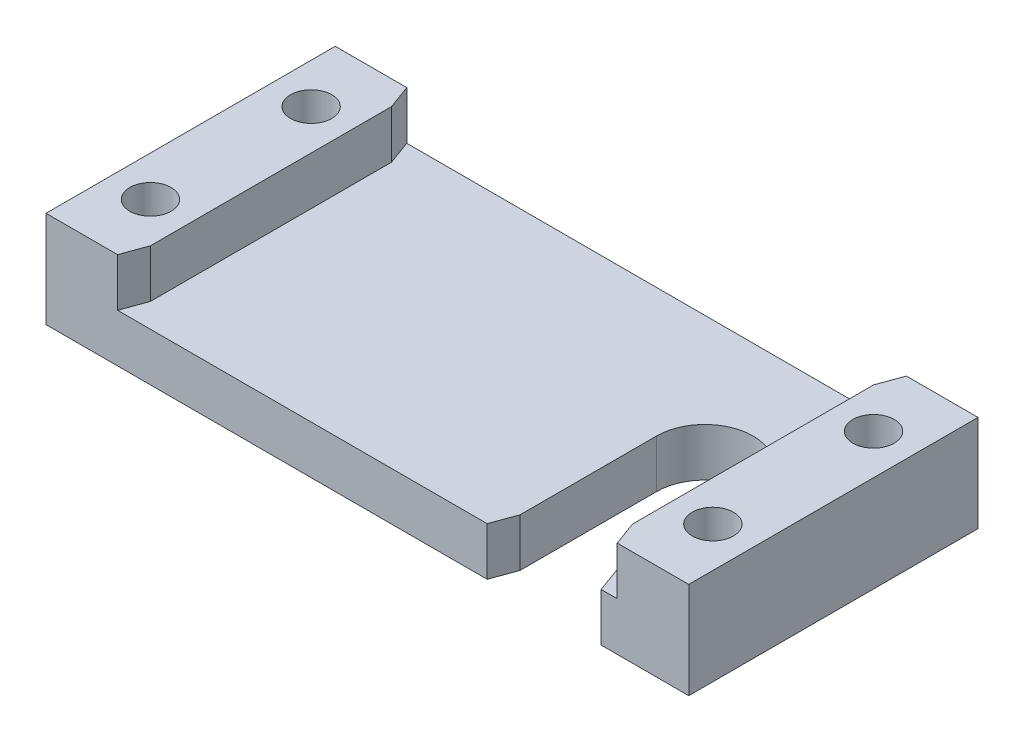
from build123d import *
from OCP.BRepFilletAPI import BRepFilletAPI_MakeChamfer

# Parameters (mm, degrees)
BOSS_EXTRUDE1_DEPTH   = 11.43
F_4_CLEARANCE_HOLE1_D = 3.2639
CUT_EXTRUDE1_DEPTH    = 29.112648399
CHAMFER1_SIZE         = 1.905
CHAMFER1_SIZE2        = 0.693363296


with BuildPart() as part:
    # Sketch1 → Boss-Extrude1 (new, symmetric)
    with BuildSketch(Plane.XY):
        Polygon((-19.05, 3.81), (-25.4, 3.81), (-25.4, -3.81), (25.4, -3.81), (25.4, 3.81), (19.05, 3.81), (19.05, 0), (-19.05, 0), align=None)
    extrude(amount=BOSS_EXTRUDE1_DEPTH, both=True)

    # #4 Clearance Hole1 (through all)
    with Locations(Plane(origin=(0, 3.81, 0), x_dir=(1, 0, 0), z_dir=(0, 1, 0))):
        with Locations((22.225, -6.35), (-22.225, 6.35), (-22.225, -6.35), (22.225, 6.35)):
            Hole(F_4_CLEARANCE_HOLE1_D / 2)

    # Sketch4 → Cut-Extrude1 (cut, through all)
    with BuildSketch(Plane(origin=(0, 0, 0), x_dir=(1, 0, 0), z_dir=(0, 1, 0))):
        with BuildLine():
            Line((17.78, -11.43), (17.78, 1.27))
            ThreePointArc((17.78, 1.27), (13.97, 5.08), (10.16, 1.27))
            Line((10.16, 1.27), (10.16, -11.43))
            Line((10.16, -11.43), (17.78, -11.43))
        make_face()
    extrude(amount=-CUT_EXTRUDE1_DEPTH, mode=Mode.SUBTRACT)

    # Chamfer1: one chamfer whose edges measure the first distance from different faces: ONE call of the kernel's chamfer builder (chamfer() names one face for all edges)
    chamfer1_edges_1 = [part.edges().sort_by_distance(p)[0] for p in [
        (19.05, 1.905, 11.43),
        (19.05, 1.905, -11.43),
    ]]
    chamfer1_side_1 = [part.faces().sort_by_distance(p)[0] for p in [
        (19.05, 1.905, 0),
    ]]
    chamfer1_edges_2 = [part.edges().sort_by_distance(p)[0] for p in [
        (-19.05, 1.905, -11.43),
        (-19.05, 1.905, 11.43),
    ]]
    chamfer1_side_2 = [part.faces().sort_by_distance(p)[0] for p in [
        (-19.05, 1.905, 0),
    ]]
    chamfer1_edges_3 = [part.edges().sort_by_distance(p)[0] for p in [
        (17.78, -1.905, 11.43),
    ]]
    chamfer1_side_3 = [part.faces().sort_by_distance(p)[0] for p in [
        (17.78, -1.905, 5.08),
    ]]
    chamfer1_edges_4 = [part.edges().sort_by_distance(p)[0] for p in [
        (10.16, -1.905, 11.43),
    ]]
    chamfer1_side_4 = [part.faces().sort_by_distance(p)[0] for p in [
        (10.16, -1.905, 5.08),
    ]]
    chamfer1 = BRepFilletAPI_MakeChamfer(part.part.solid().wrapped)
    for e in chamfer1_edges_1:
        chamfer1.Add(CHAMFER1_SIZE, CHAMFER1_SIZE2, e.wrapped, chamfer1_side_1[0].wrapped)  # the first distance lies on this face
    for e in chamfer1_edges_2:
        chamfer1.Add(CHAMFER1_SIZE, CHAMFER1_SIZE2, e.wrapped, chamfer1_side_2[0].wrapped)  # the first distance lies on this face
    for e in chamfer1_edges_3:
        chamfer1.Add(CHAMFER1_SIZE, CHAMFER1_SIZE2, e.wrapped, chamfer1_side_3[0].wrapped)  # the first distance lies on this face
    for e in chamfer1_edges_4:
        chamfer1.Add(CHAMFER1_SIZE, CHAMFER1_SIZE2, e.wrapped, chamfer1_side_4[0].wrapped)  # the first distance lies on this face
    add(Compound.cast(chamfer1.Shape()), mode=Mode.REPLACE)


solid = part.part
